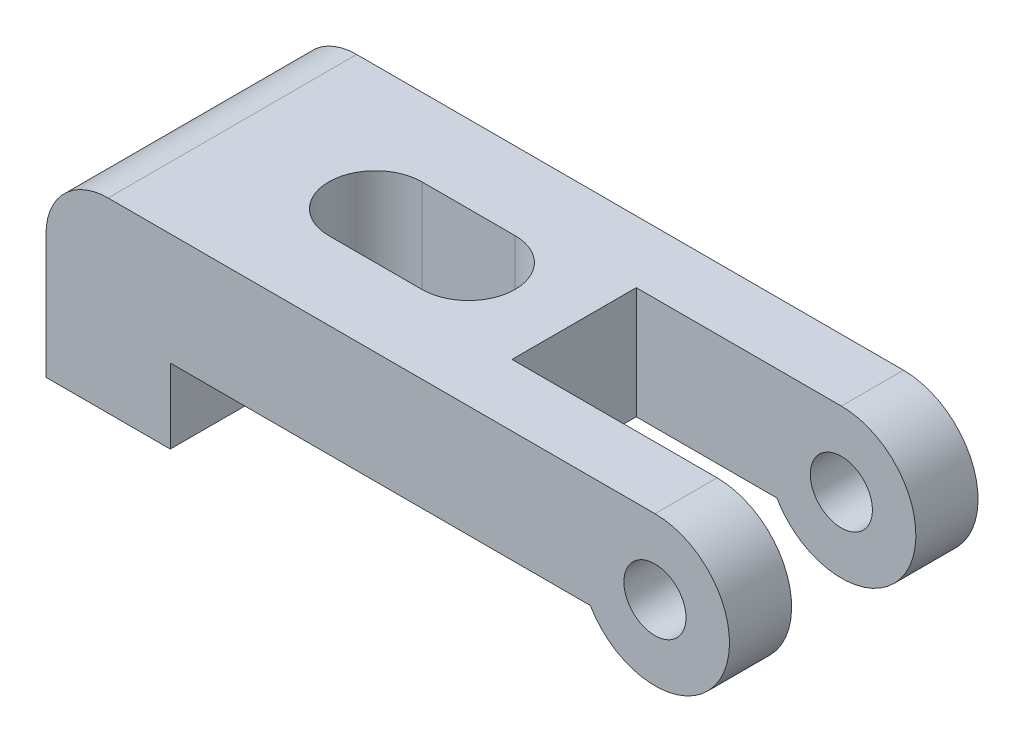
from build123d import *

# Parameters (mm, degrees)
ESQUISSE1_R             = 50
BOSS_EXTRU_1_DEPTH      = 400
ESQUISSE2_W             = 600
ESQUISSE2_H             = 200
ENL_V_MAT_EXTRU_1_DEPTH = 1209.304597359


with BuildPart() as part:
    # Esquisse1 → Boss.-Extru.1 (new body)
    with BuildSketch(Plane.XY):
        with BuildLine():
            Line((0, 0), (0, 200))
            ThreePointArc((0, 200), (29.289321881, 270.710678119), (100, 300))
            Line((100, 300), (980, 300))
            ThreePointArc((980, 300), (1083.923048454, 120), (876.076951546, 120))
            Line((876.076951546, 120), (200, 120))
            Line((200, 120), (200, 0))
            Line((200, 0), (0, 0))
        make_face()
        with Locations((980, 180)):
            Circle(ESQUISSE1_R, mode=Mode.SUBTRACT)
    extrude(amount=BOSS_EXTRU_1_DEPTH)

    # Esquisse2 → Enlèv. mat.-Extru.1 (cut, through all)
    with BuildSketch(Plane(origin=(0, 300, 0), x_dir=(1, 0, 0), z_dir=(0, 1, 0))):
        with BuildLine():
            Line((330, -125), (480, -125))
            ThreePointArc((480, -125), (555, -200), (480, -275))
            Line((480, -275), (330, -275))
            ThreePointArc((330, -275), (255, -200), (330, -125))
        make_face()
        with Locations((950, -200)):
            Rectangle(ESQUISSE2_W, ESQUISSE2_H)
    extrude(amount=-ENL_V_MAT_EXTRU_1_DEPTH, mode=Mode.SUBTRACT)


solid = part.part
